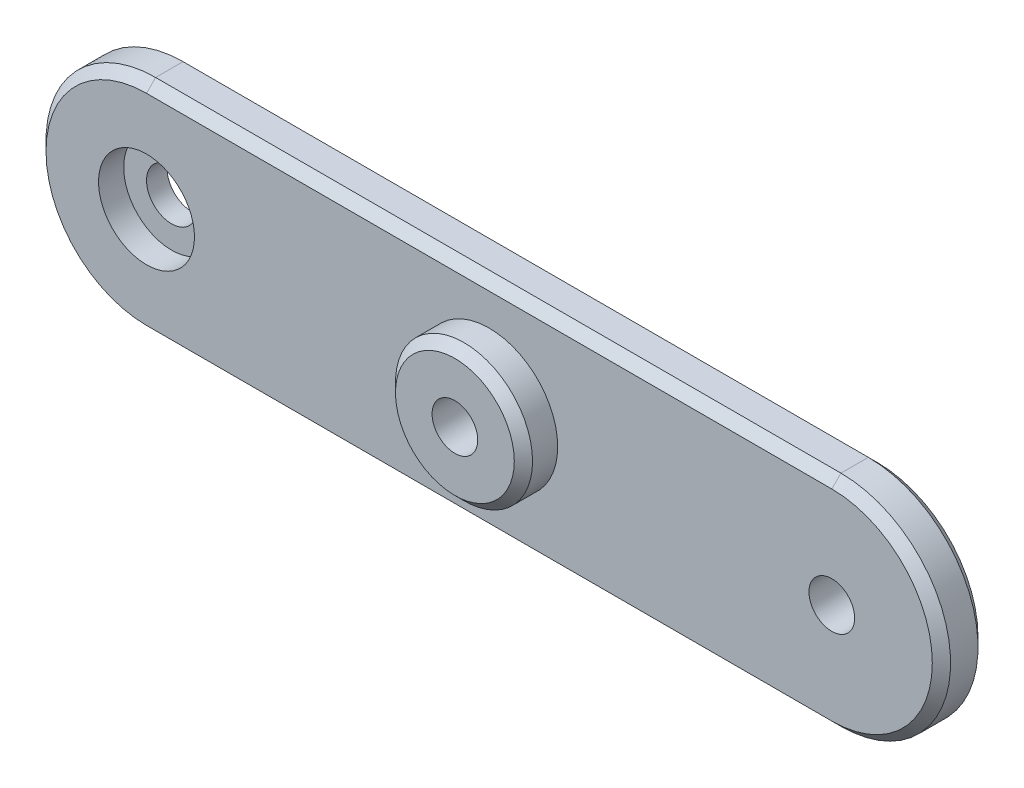
from build123d import *

# Parameters (mm, degrees)
BOSS_EXTRUDE1_DEPTH             = 5
SKETCH4_R                       = 7.5
BOSS_EXTRUDE3_DEPTH             = 8.75
SKETCH5_R                       = 2.5
CUT_EXTRUDE2_DEPTH              = 10
CBORE_FOR_M5_SBHCS1_D           = 5.5
CBORE_FOR_M5_SBHCS1_CBORE_D     = 10.5
CBORE_FOR_M5_SBHCS1_CBORE_DEPTH = 2.75
SKETCH8_R                       = 2.5
CUT_EXTRUDE3_DEPTH              = 10
CHAMFER1_SIZE                   = 1


with BuildPart() as part:
    # Sketch2 → Boss-Extrude1 (new body)
    with BuildSketch(Plane.XY):
        with BuildLine():
            Line((-37.5, 12), (37.5, 12))
            ThreePointArc((37.5, 12), (49.5, 0), (37.5, -12))
            Line((37.5, -12), (-37.5, -12))
            ThreePointArc((-37.5, -12), (-49.5, 0), (-37.5, 12))
        make_face()
    extrude(amount=BOSS_EXTRUDE1_DEPTH)

    # Sketch4 → Boss-Extrude3 (add)
    with BuildSketch(Plane.XY):
        Circle(SKETCH4_R)
    extrude(amount=BOSS_EXTRUDE3_DEPTH)

    # Sketch5 → Cut-Extrude2 (cut)
    with BuildSketch(Plane.XY.offset(8.75)):
        Circle(SKETCH5_R)
    extrude(amount=-CUT_EXTRUDE2_DEPTH, mode=Mode.SUBTRACT)

    # CBORE for M5 SBHCS1 (through all)
    with Locations(Plane.XY.offset(5)):
        with Locations((-37.5, 0)):
            CounterBoreHole(CBORE_FOR_M5_SBHCS1_D / 2, CBORE_FOR_M5_SBHCS1_CBORE_D / 2, CBORE_FOR_M5_SBHCS1_CBORE_DEPTH)

    # Sketch8 → Cut-Extrude3 (cut)
    with BuildSketch(Plane.XY.offset(5)):
        with Locations((37.5, 0)):
            Circle(SKETCH8_R)
    extrude(amount=-CUT_EXTRUDE3_DEPTH, mode=Mode.SUBTRACT)

    # Chamfer1
    chamfer1_edges = [part.edges().sort_by_distance(p)[0] for p in [
        (49.5, 0, 5),
        (-7.5, 0, 8.75),
        (0, 12, 5),
        (-49.5, 0, 5),
        (0, 12, 0),
        (49.5, 0, 0),
        (0, -12, 0),
        (-49.5, 0, 0),
        (0, -12, 5),
    ]]
    chamfer(chamfer1_edges, length=CHAMFER1_SIZE)


solid = part.part
